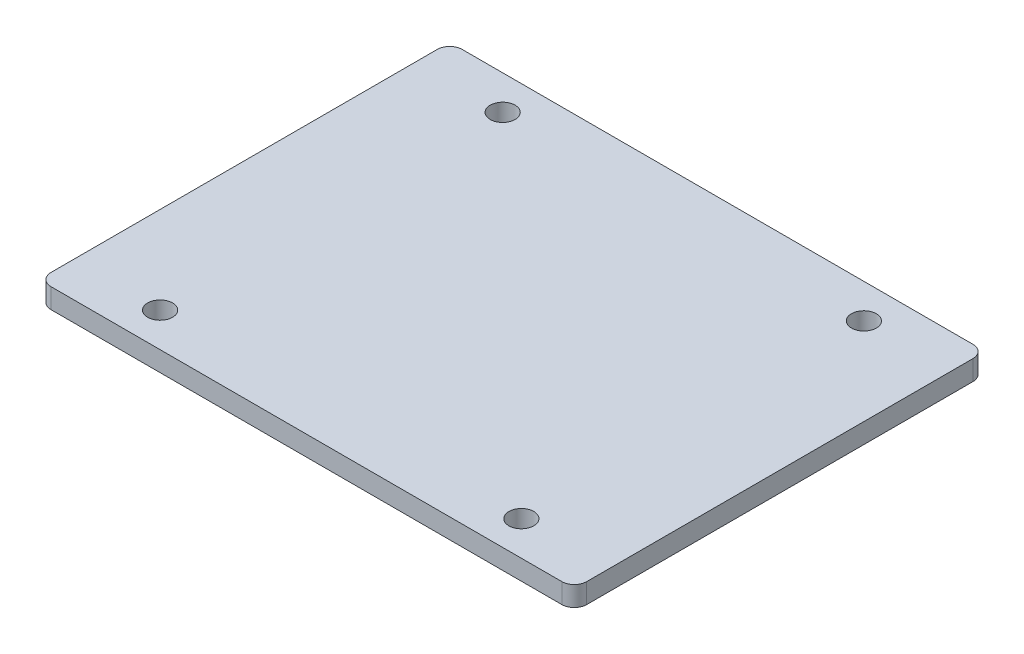
from build123d import *

# Parameters (mm, degrees)
BOSS_EXTRU_1_DEPTH      = 1.6
ENL_V_MAT_EXTRU_1_REACH = 29.149
ESQUISSE2_R             = 1


with BuildPart() as part:
    # Esquisse1 → Boss.-Extru.1 (new body)
    with BuildSketch(Plane(origin=(0, 0, 0), x_dir=(1, 0, 0), z_dir=(0, 1, 0))):
        with BuildLine():
            Line((-20.5, -16.5), (20.5, -16.5))
            ThreePointArc((20.5, -16.5), (21.207106781, -16.207106781), (21.5, -15.5))
            Line((21.5, -15.5), (21.5, 15.5))
            ThreePointArc((21.5, 15.5), (21.207106781, 16.207106781), (20.5, 16.5))
            Line((20.5, 16.5), (-20.5, 16.5))
            ThreePointArc((-20.5, 16.5), (-21.207106781, 16.207106781), (-21.5, 15.5))
            Line((-21.5, 15.5), (-21.5, -15.5))
            ThreePointArc((-21.5, -15.5), (-21.207106781, -16.207106781), (-20.5, -16.5))
        make_face()
    extrude(amount=BOSS_EXTRU_1_DEPTH)

    # Esquisse2 → Enlèv. mat.-Extru.1 (cut, up to next)
    with BuildSketch(Plane(origin=(0, 1.6, 0), x_dir=(1, 0, 0), z_dir=(0, 1, 0)), mode=Mode.PRIVATE) as enl_v_mat_extru_1_sk1:
        with Locations(Location((-14.5, 13.75, 0), (0, 0, 270))):
            Circle(ESQUISSE2_R)
    enl_v_mat_extru_1_tool1 = extrude(enl_v_mat_extru_1_sk1.sketch, amount=-ENL_V_MAT_EXTRU_1_REACH, mode=Mode.PRIVATE) & part.part
    # Esquisse2 → Enlèv. mat.-Extru.1 (cut, up to next)
    with BuildSketch(Plane(origin=(0, 1.6, 0), x_dir=(1, 0, 0), z_dir=(0, 1, 0)), mode=Mode.PRIVATE) as enl_v_mat_extru_1_sk2:
        with Locations(Location((14.5, 13.75, 0), (0, 0, 270))):
            Circle(ESQUISSE2_R)
    enl_v_mat_extru_1_tool2 = extrude(enl_v_mat_extru_1_sk2.sketch, amount=-ENL_V_MAT_EXTRU_1_REACH, mode=Mode.PRIVATE) & part.part
    # Esquisse2 → Enlèv. mat.-Extru.1 (cut, up to next)
    with BuildSketch(Plane(origin=(0, 1.6, 0), x_dir=(1, 0, 0), z_dir=(0, 1, 0)), mode=Mode.PRIVATE) as enl_v_mat_extru_1_sk3:
        with Locations(Location((14.5, -13.75, 0), (0, 0, 270))):
            Circle(ESQUISSE2_R)
    enl_v_mat_extru_1_tool3 = extrude(enl_v_mat_extru_1_sk3.sketch, amount=-ENL_V_MAT_EXTRU_1_REACH, mode=Mode.PRIVATE) & part.part
    # Esquisse2 → Enlèv. mat.-Extru.1 (cut, up to next)
    with BuildSketch(Plane(origin=(0, 1.6, 0), x_dir=(1, 0, 0), z_dir=(0, 1, 0)), mode=Mode.PRIVATE) as enl_v_mat_extru_1_sk4:
        with Locations(Location((-14.5, -13.75, 0), (0, 0, 270))):
            Circle(ESQUISSE2_R)
    enl_v_mat_extru_1_tool4 = extrude(enl_v_mat_extru_1_sk4.sketch, amount=-ENL_V_MAT_EXTRU_1_REACH, mode=Mode.PRIVATE) & part.part
    add(enl_v_mat_extru_1_tool1.solids().sort_by_distance((-14.5, 1.6, -13.75))[0], mode=Mode.SUBTRACT)
    add(enl_v_mat_extru_1_tool2.solids().sort_by_distance((14.5, 1.6, -13.75))[0], mode=Mode.SUBTRACT)
    add(enl_v_mat_extru_1_tool3.solids().sort_by_distance((14.5, 1.6, 13.75))[0], mode=Mode.SUBTRACT)
    add(enl_v_mat_extru_1_tool4.solids().sort_by_distance((-14.5, 1.6, 13.75))[0], mode=Mode.SUBTRACT)


solid = part.part
